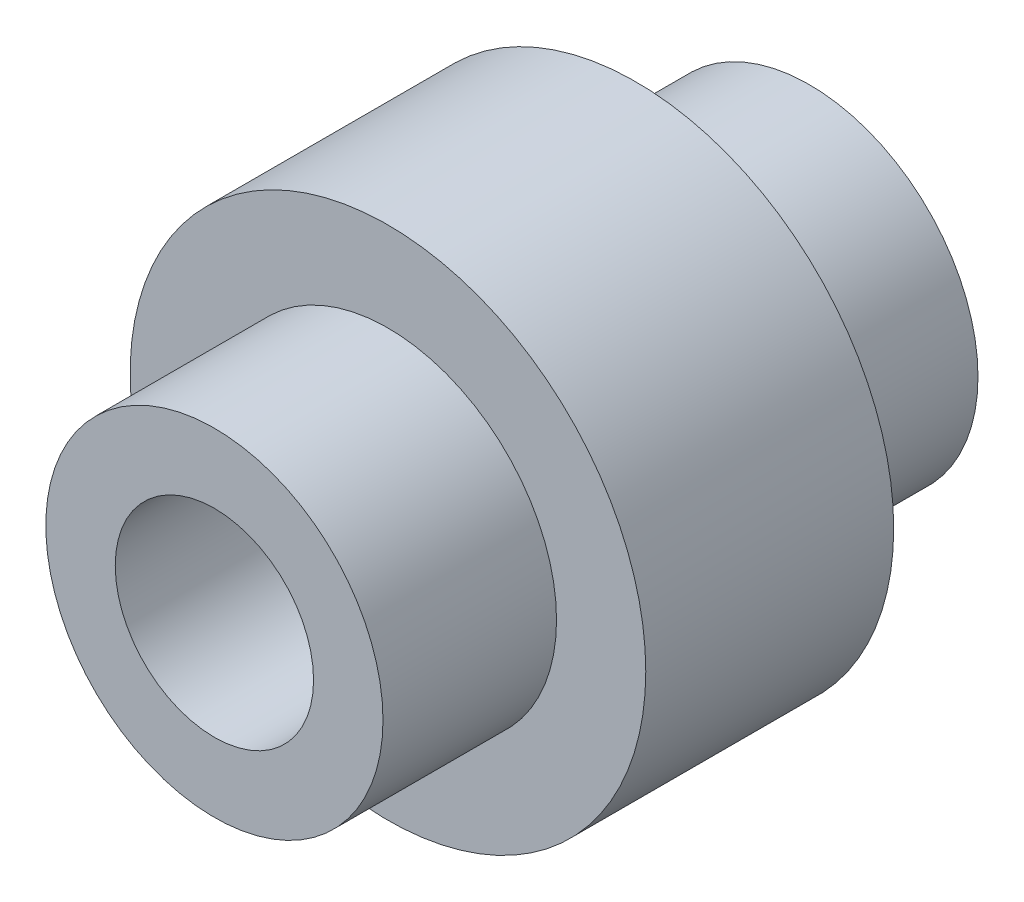
from build123d import *

# Parameters (mm, degrees)
SKETCH_1_R      = 52
SKETCH_1_R_2    = 34
EXTRUDE_1_DEPTH = 25
SKETCH_1_3_R    = 34
SKETCH_1_3_R_2  = 20
EXTRUDE_2_DEPTH = 60
SKETCH_2_R      = 20
SKETCH_2_R_2    = 11
EXTRUDE_3_DEPTH = 35


with BuildPart() as part:
    # 草图1 → 凸台-拉伸1 (new, symmetric)
    with BuildSketch(Plane.XY):
        Circle(SKETCH_1_R)
        Circle(SKETCH_1_R_2, mode=Mode.SUBTRACT)
    extrude(amount=EXTRUDE_1_DEPTH, both=True)

    # 草图1<3> → 凸台-拉伸2 (add, symmetric)
    with BuildSketch(Plane.XY):
        Circle(SKETCH_1_3_R)
        Circle(SKETCH_1_3_R_2, mode=Mode.SUBTRACT)
    extrude(amount=EXTRUDE_2_DEPTH, both=True)

    # 草图2 → 凸台-拉伸3 (add)
    with BuildSketch(Plane(origin=(0, 0, -60), x_dir=(-1, 0, 0), z_dir=(0, 0, -1))):
        Circle(SKETCH_2_R)
        Circle(SKETCH_2_R_2, mode=Mode.SUBTRACT)
    extrude(amount=-EXTRUDE_3_DEPTH)


solid = part.part
